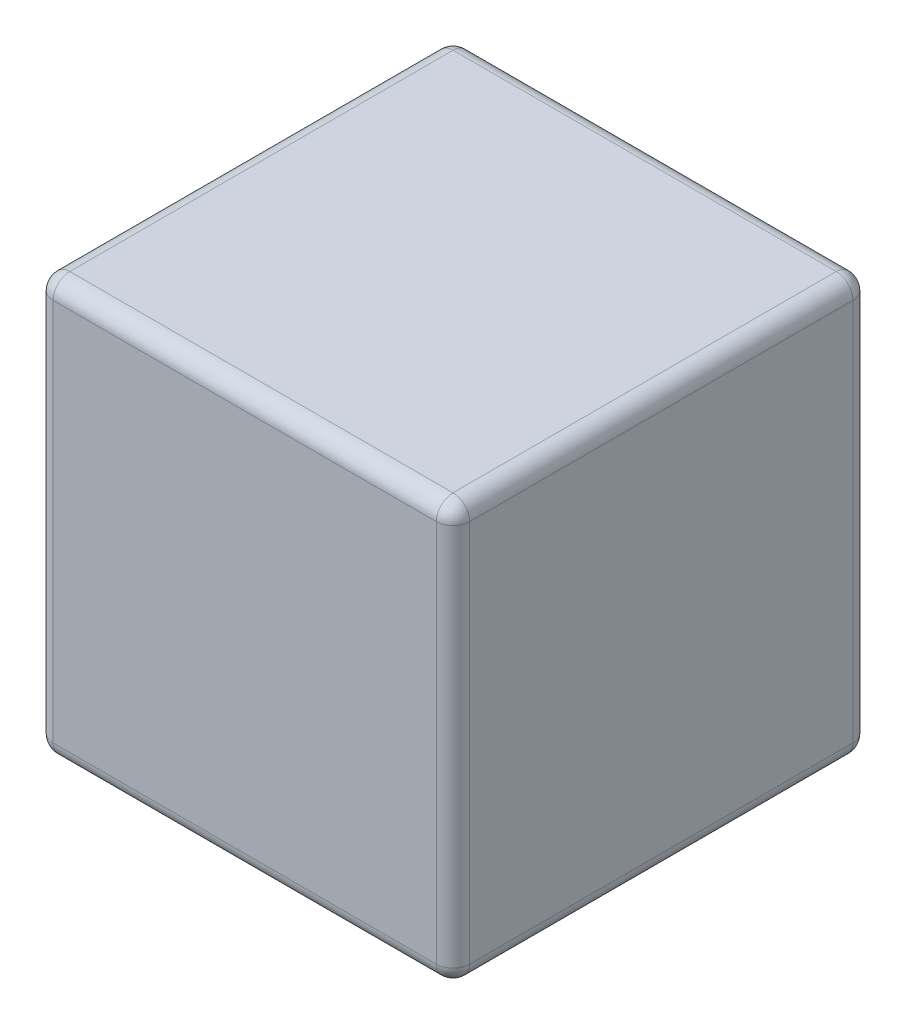
from build123d import *

# Parameters (mm, degrees)
SKETCH1_W           = 250
SKETCH1_H           = 250
BOSS_EXTRUDE1_DEPTH = 125
FILLET1_R           = 10
SKETCH2_W           = 2.243589744
SKETCH2_H           = 25
CUT_EXTRUDE1_DEPTH  = 5


with BuildPart() as part:
    # Sketch1 → Boss-Extrude1 (new, symmetric)
    with BuildSketch(Plane(origin=(0, 0, 0), x_dir=(1, 0, 0), z_dir=(0, 1, 0))):
        Rectangle(SKETCH1_W, SKETCH1_H)
    extrude(amount=BOSS_EXTRUDE1_DEPTH, both=True)

    # Fillet1
    fillet1_edges = [part.edges().sort_by_distance(p)[0] for p in [
        (-125, 125, 0),
        (0, 125, 125),
        (125, 125, 0),
        (0, -125, 125),
        (-125, -125, 0),
        (0, -125, -125),
        (125, -125, 0),
        (125, 0, 125),
        (-125, 0, 125),
        (-125, 0, -125),
        (125, 0, -125),
        (0, 125, -125),
    ]]
    fillet(fillet1_edges, radius=FILLET1_R)

    # Sketch2 → Cut-Extrude1 (cut)
    # profile 1 of 11: a face of its own
    with BuildSketch(Plane(origin=(0, 0, -125), x_dir=(-1, 0, 0), z_dir=(0, 0, -1))):
        Polygon((-103.958881832, 105.864219876), (-101.715292089, 105.864219876), (-101.715292089, 83.42832244), (-92.099907473, 83.42832244), (-92.099907473, 80.864219876), (-103.958881832, 80.864219876), align=None)
    # profile 2 of 11: a face of its own
    with BuildSketch(Plane(origin=(0, 0, -125), x_dir=(-1, 0, 0), z_dir=(0, 0, -1))):
        with Locations((-86.811445935, 93.364219876)):
            Rectangle(SKETCH2_W, SKETCH2_H)
    # profile 3 of 11: a face of its own
    with BuildSketch(Plane(origin=(0, 0, -125), x_dir=(-1, 0, 0), z_dir=(0, 0, -1))):
        Polygon((-79.279394653, 105.864219876), (-67.099907473, 105.864219876), (-67.099907473, 103.300117312), (-77.035804909, 103.300117312), (-77.035804909, 95.60780962), (-67.099907473, 95.60780962), (-67.099907473, 93.043707055), (-77.035804909, 93.043707055), (-77.035804909, 80.864219876), (-79.279394653, 80.864219876), align=None)
    # profile 4 of 11: a face of its own
    with BuildSketch(Plane(origin=(0, 0, -125), x_dir=(-1, 0, 0), z_dir=(0, 0, -1))):
        Polygon((-62.612727986, 105.864219876), (-48.510163884, 105.864219876), (-48.510163884, 103.300117312), (-60.369138243, 103.300117312), (-60.369138243, 95.60780962), (-48.510163884, 95.60780962), (-48.510163884, 93.043707055), (-60.369138243, 93.043707055), (-60.369138243, 83.42832244), (-48.510163884, 83.42832244), (-48.510163884, 80.864219876), (-62.612727986, 80.864219876), align=None)
    # profile 5 of 11: a face of its own
    with BuildSketch(Plane(origin=(0, 0, -125), x_dir=(-1, 0, 0), z_dir=(0, 0, -1))):
        with BuildLine():
            Line((-36.971702345, 85.686936222), (-34.858320935, 86.953963466))
            add(Edge.make_bspline(
                [(-34.858320935, 86.953963466), (-34.661762098, 86.624932145), (-34.28516295, 85.994520831), (-33.656938956, 85.142677685), (-33.005989591, 84.41866228), (-32.327494351, 83.826686512), (-31.625594722, 83.360623035), (-30.895708624, 83.030607094), (-30.14029569, 82.824778698), (-29.626196965, 82.79977808), (-29.369538884, 82.787296799)],
                knots=[0, 0, 0, 0, 1.272034388, 2.437168799, 3.508375237, 4.49857839, 5.41946034, 6.295179144, 7.148887113, 8, 8, 8, 8], degree=3))
            add(Edge.make_bspline(
                [(-29.369538884, 82.787296799), (-29.150347023, 82.793401603), (-28.715798644, 82.80550439), (-28.076068337, 82.921795833), (-27.45476975, 83.100453897), (-26.864708051, 83.356317694), (-26.314025091, 83.665878306), (-25.831120124, 84.039779574), (-25.413647887, 84.458395329), (-25.072154211, 84.925414291), (-24.810153959, 85.427679638), (-24.608782042, 85.943222147), (-24.497031516, 86.480140492), (-24.480197563, 86.841643798), (-24.471702345, 87.024075645)],
                knots=[0, 0, 0, 0, 1.095163259, 2.171163733, 3.241058638, 4.321873601, 5.38011039, 6.391990106, 7.366004449, 8.327778327, 9.272591725, 10.192022065, 11.087607919, 12, 12, 12, 12], degree=3))
            add(Edge.make_bspline(
                [(-24.471702345, 87.024075645), (-24.482233136, 87.232224572), (-24.503640695, 87.655360923), (-24.684579838, 88.279644158), (-24.969217315, 88.89744823), (-25.231807628, 89.279600127), (-25.36813664, 89.478001927)],
                knots=[0, 0, 0, 0, 0.938893495, 1.908633276, 2.914225137, 4, 4, 4, 4], degree=3))
            add(Edge.make_bspline(
                [(-25.36813664, 89.478001927), (-25.480069599, 89.621193524), (-25.715058844, 89.921806371), (-26.119041076, 90.369272339), (-26.59308475, 90.830832474), (-27.120967285, 91.324111453), (-27.72191792, 91.826167143), (-28.377114451, 92.360940557), (-29.103284872, 92.908094679), (-29.612566991, 93.275041576), (-29.875348179, 93.464380132)],
                knots=[0, 0, 0, 0, 0.722233717, 1.516239348, 2.393582979, 3.351407094, 4.387010283, 5.505090956, 6.712668013, 8, 8, 8, 8], degree=3))
            add(Edge.make_bspline(
                [(-29.875348179, 93.464380132), (-30.138376723, 93.651727187), (-30.64126727, 94.009920489), (-31.344542858, 94.541522517), (-31.973431879, 95.027550157), (-32.52513914, 95.472578815), (-32.999421975, 95.876668848), (-33.400017768, 96.235939842), (-33.716721747, 96.560108134), (-33.892833038, 96.770403432), (-33.971902666, 96.864820837)],
                knots=[0, 0, 0, 0, 1.452282411, 2.77665338, 3.964542531, 5.026858415, 5.96415736, 6.766646006, 7.446254459, 8, 8, 8, 8], degree=3))
            add(Edge.make_bspline(
                [(-33.971902666, 96.864820837), (-34.082420846, 97.011971101), (-34.29976968, 97.301361842), (-34.586669719, 97.753682255), (-34.830520882, 98.216705579), (-35.021680397, 98.69167604), (-35.182653389, 99.171925532), (-35.290924322, 99.663720144), (-35.358720014, 100.164853133), (-35.365662775, 100.502092423), (-35.369138243, 100.670910581)],
                knots=[0, 0, 0, 0, 1.068054152, 2.10047183, 3.106115577, 4.101338837, 5.06977816, 6.043150881, 7.020423561, 8, 8, 8, 8], degree=3))
            add(Edge.make_bspline(
                [(-35.369138243, 100.670910581), (-35.359815321, 100.935408971), (-35.341368749, 101.458752283), (-35.185365055, 102.223258215), (-34.9391301, 102.953161195), (-34.594166615, 103.641235007), (-34.149471237, 104.269563442), (-33.634857135, 104.845374064), (-33.021917947, 105.329435365), (-32.34939921, 105.752378639), (-31.613282266, 106.083420962), (-30.841918671, 106.333142249), (-30.034082442, 106.474636947), (-29.486917194, 106.494942411), (-29.209282473, 106.505245517)],
                knots=[0, 0, 0, 0, 1.005424448, 1.989358655, 2.955360095, 3.929531133, 4.905563448, 5.876582895, 6.856512386, 7.866279853, 8.892233794, 9.918561126, 10.94386622, 12, 12, 12, 12], degree=3))
            add(Edge.make_bspline(
                [(-29.209282473, 106.505245517), (-28.914681757, 106.495084434), (-28.328814959, 106.474877283), (-27.467034848, 106.299180631), (-26.637315445, 106.008461547), (-25.969863553, 105.678542561), (-25.447486686, 105.349032449), (-25.049110024, 105.048890847), (-24.645413947, 104.703354357), (-24.233142126, 104.311502599), (-23.819280273, 103.869740092), (-23.397684186, 103.381092314), (-22.96736798, 102.848545486), (-22.690540408, 102.468370481), (-22.548625422, 102.273474684)],
                knots=[0, 0, 0, 0, 1.286793592, 2.559021753, 3.825965368, 5.121522368, 5.803751409, 6.523245864, 7.299691795, 8.125521123, 9.008227632, 9.944561021, 10.946284179, 12, 12, 12, 12], degree=3))
            Line((-22.548625422, 102.273474684), (-24.576870614, 100.736014748))
            add(Edge.make_bspline(
                [(-24.576870614, 100.736014748), (-24.699341561, 100.893791108), (-24.935191968, 101.197631488), (-25.293259732, 101.623140885), (-25.630750074, 102.011830025), (-25.96325293, 102.349438082), (-26.27320744, 102.65445332), (-26.574043456, 102.91559444), (-26.861431679, 103.135420122), (-27.223695327, 103.370016979), (-27.678821886, 103.602563433), (-28.250140002, 103.799342562), (-28.847184824, 103.917593004), (-29.253825049, 103.933227915), (-29.459683114, 103.941142953)],
                knots=[0, 0, 0, 0, 1.181633172, 2.275549214, 3.290209073, 4.226197932, 5.078386478, 5.862611352, 6.581680152, 7.217281963, 8.414376989, 9.595101626, 10.782541182, 12, 12, 12, 12], degree=3))
            add(Edge.make_bspline(
                [(-29.459683114, 103.941142953), (-29.717943989, 103.932487953), (-30.215975756, 103.915797602), (-30.923048871, 103.733511992), (-31.55943405, 103.446498705), (-32.106238086, 103.044248861), (-32.561502208, 102.567670342), (-32.890826913, 102.019249948), (-33.089042375, 101.413661358), (-33.113230086, 100.991220956), (-33.125548499, 100.77607885)],
                knots=[0, 0, 0, 0, 1.14458467, 2.207223713, 3.21896685, 4.227309161, 5.202851033, 6.127160689, 7.046193047, 8, 8, 8, 8], degree=3))
            add(Edge.make_bspline(
                [(-33.125548499, 100.77607885), (-33.122740452, 100.642139718), (-33.117119765, 100.374042436), (-33.038728353, 99.977960851), (-32.938018861, 99.582879855), (-32.778428634, 99.190575692), (-32.558105037, 98.794187413), (-32.268782352, 98.386889287), (-31.904401551, 97.965091368), (-31.625280034, 97.690752984), (-31.477912281, 97.545910581)],
                knots=[0, 0, 0, 0, 0.858281714, 1.717966888, 2.583508476, 3.4729293, 4.427298488, 5.488583878, 6.674047936, 8, 8, 8, 8], degree=3))
            add(Edge.make_bspline(
                [(-31.477912281, 97.545910581), (-31.423188193, 97.497074682), (-31.293176284, 97.381051766), (-31.055491101, 97.191106904), (-30.74161397, 96.956801388), (-30.359741105, 96.666891984), (-29.902831378, 96.330595826), (-29.370834549, 95.952212882), (-28.769680743, 95.519459604), (-28.343095629, 95.216905742), (-28.117535679, 95.056928209)],
                knots=[0, 0, 0, 0, 0.420754252, 0.999615792, 1.744751191, 2.668019286, 3.750313428, 4.999500688, 6.413464383, 8, 8, 8, 8], degree=3))
            add(Edge.make_bspline(
                [(-28.117535679, 95.056928209), (-27.846207726, 94.859489927), (-27.320818752, 94.477178057), (-26.57326461, 93.902780343), (-25.895451695, 93.341010567), (-25.285000241, 92.795456231), (-24.735879466, 92.270255566), (-24.254181462, 91.759089993), (-23.834998031, 91.265621616), (-23.383717899, 90.632960361), (-22.922590616, 89.855952617), (-22.526579849, 88.903965198), (-22.276877367, 87.948277195), (-22.244223686, 87.305942649), (-22.228112602, 86.989019555)],
                knots=[0, 0, 0, 0, 1.163667725, 2.253281268, 3.268753668, 4.215851969, 5.092017293, 5.902905408, 6.650798638, 7.335211899, 8.59617414, 9.77448103, 10.901945474, 12, 12, 12, 12], degree=3))
            add(Edge.make_bspline(
                [(-22.228112602, 86.989019555), (-22.232806445, 86.764888376), (-22.242102982, 86.320978494), (-22.348966651, 85.669156516), (-22.505535688, 85.036078875), (-22.741515931, 84.429570929), (-23.02953849, 83.83853691), (-23.395011689, 83.278480479), (-23.818638008, 82.737006203), (-24.304593472, 82.228552693), (-24.836349917, 81.761794151), (-25.398376308, 81.346586569), (-25.991592543, 81.000384259), (-26.612780519, 80.717878244), (-27.262082924, 80.496924547), (-27.93928138, 80.336832625), (-28.645492175, 80.238577547), (-29.125495614, 80.228379251), (-29.369538884, 80.223194235)],
                knots=[0, 0, 0, 0, 0.983748083, 1.948392443, 2.894712957, 3.844097841, 4.80183111, 5.778335162, 6.776009319, 7.81870978, 8.863265674, 9.881300176, 10.883814829, 11.87499822, 12.874611388, 13.892143829, 14.928324115, 16, 16, 16, 16], degree=3))
            add(Edge.make_bspline(
                [(-29.369538884, 80.223194235), (-29.558362762, 80.226845532), (-29.933632477, 80.234102142), (-30.488700205, 80.298254145), (-31.032554413, 80.389019171), (-31.558370713, 80.53311967), (-32.072923654, 80.707955221), (-32.573975329, 80.923229025), (-33.061768571, 81.181209035), (-33.53903702, 81.476173497), (-34.004566838, 81.819443101), (-34.453991609, 82.21925379), (-34.90205722, 82.664578826), (-35.335538622, 83.167511421), (-35.763203939, 83.719926299), (-36.17662115, 84.326991894), (-36.584347704, 84.985401564), (-36.840172475, 85.448723605), (-36.971702345, 85.686936222)],
                knots=[0, 0, 0, 0, 0.915332311, 1.819136955, 2.706846663, 3.586547465, 4.459518054, 5.340707479, 6.227863349, 7.133153174, 8.059268498, 9.028702269, 10.047606654, 11.120612155, 12.245963614, 13.433783089, 14.680604001, 16, 16, 16, 16], degree=3))
        make_face()
    # profile 6 of 11: a face of its own
    with BuildSketch(Plane(origin=(0, 0, -125), x_dir=(-1, 0, 0), z_dir=(0, 0, -1))):
        with BuildLine():
            Line((-17.099907473, 105.864219876), (-14.85631773, 105.864219876))
            Line((-14.85631773, 105.864219876), (-14.85631773, 90.88525353))
            add(Edge.make_bspline(
                [(-14.85631773, 90.88525353), (-14.856651615, 90.673248274), (-14.857285221, 90.270931768), (-14.853052979, 89.69830105), (-14.841200347, 89.189212056), (-14.833727779, 88.741702431), (-14.817103968, 88.357825663), (-14.80354649, 88.035502016), (-14.786113942, 87.776257712), (-14.765163103, 87.624965383), (-14.756157473, 87.559933017)],
                knots=[0, 0, 0, 0, 1.528628734, 2.90083645, 4.128790002, 5.200304208, 6.127813768, 6.898992206, 7.526736466, 8, 8, 8, 8], degree=3))
            add(Edge.make_bspline(
                [(-14.756157473, 87.559933017), (-14.719175625, 87.325313279), (-14.647295722, 86.869293785), (-14.46410731, 86.219948915), (-14.208268017, 85.634724213), (-13.905103426, 85.095357848), (-13.505584774, 84.616862419), (-13.026988093, 84.176064899), (-12.447146889, 83.790552008), (-11.802428277, 83.43804621), (-11.107533724, 83.154724193), (-10.39745325, 82.940485876), (-9.682860541, 82.809922306), (-9.204459362, 82.794804171), (-8.966894653, 82.787296799)],
                knots=[0, 0, 0, 0, 1.035780045, 2.013197591, 2.933192213, 3.817615948, 4.702609284, 5.640816605, 6.646850145, 7.73207398, 8.84249596, 9.914020372, 10.964143139, 12, 12, 12, 12], degree=3))
            add(Edge.make_bspline(
                [(-8.966894653, 82.787296799), (-8.762939364, 82.794967158), (-8.356206779, 82.810263575), (-7.751875132, 82.904988082), (-7.163302927, 83.075706408), (-6.587583785, 83.295990397), (-6.047933896, 83.587044619), (-5.544052167, 83.923264901), (-5.09430978, 84.317628301), (-4.68389551, 84.754059333), (-4.326503111, 85.246486476), (-4.016709242, 85.784187462), (-3.762952602, 86.375254226), (-3.63764171, 86.790642956), (-3.573264845, 87.004043594)],
                knots=[0, 0, 0, 0, 0.994687771, 1.983630487, 2.973142513, 3.978332533, 4.983357753, 5.956394766, 6.925816176, 7.893390482, 8.871859704, 9.88551698, 10.913711441, 12, 12, 12, 12], degree=3))
            add(Edge.make_bspline(
                [(-3.573264845, 87.004043594), (-3.551835379, 87.092247696), (-3.504081892, 87.288801983), (-3.459460142, 87.621096915), (-3.41298496, 88.013163801), (-3.380738032, 88.467819606), (-3.349300743, 88.983540839), (-3.33049308, 89.563014107), (-3.321799988, 90.204135256), (-3.319209414, 90.651543554), (-3.317856191, 90.88525353)],
                knots=[0, 0, 0, 0, 0.558680831, 1.244966039, 2.062412453, 2.990489873, 4.051219941, 5.244515665, 6.560634259, 8, 8, 8, 8], degree=3))
            Line((-3.317856191, 90.88525353), (-3.317856191, 105.864219876))
            Line((-3.317856191, 105.864219876), (-1.074266448, 105.864219876))
            Line((-1.074266448, 105.864219876), (-1.074266448, 90.765061222))
            add(Edge.make_bspline(
                [(-1.074266448, 90.765061222), (-1.076081593, 90.492929944), (-1.07962396, 89.961849209), (-1.110342364, 89.183625216), (-1.159320934, 88.445389635), (-1.228521563, 87.747043231), (-1.320214443, 87.091084951), (-1.422180303, 86.471765178), (-1.552034111, 85.893529517), (-1.703701262, 85.351869391), (-1.877083748, 84.83625858), (-2.101663379, 84.346911333), (-2.354695522, 83.868951335), (-2.654800185, 83.409607701), (-2.992024347, 82.966846607), (-3.373822067, 82.543353214), (-3.787566073, 82.132360026), (-4.240134356, 81.744409554), (-4.724066679, 81.38863329), (-5.237923519, 81.075792068), (-5.777757589, 80.811337658), (-6.342165633, 80.593652483), (-6.931388511, 80.429976775), (-7.54544108, 80.308011376), (-8.185721032, 80.238709251), (-8.621182862, 80.228409751), (-8.841694332, 80.223194235)],
                knots=[0, 0, 0, 0, 1.316592851, 2.569410997, 3.76748051, 4.895814652, 5.963796859, 6.97159953, 7.931736103, 8.829262218, 9.692595152, 10.560224239, 11.431080259, 12.30701507, 13.211635791, 14.121146779, 15.063487852, 16.031507147, 17.00238618, 17.966455255, 18.938106653, 19.907068911, 20.888905087, 21.893141452, 22.933117798, 24, 24, 24, 24], degree=3))
            add(Edge.make_bspline(
                [(-8.841694332, 80.223194235), (-9.082187923, 80.228799701), (-9.554035486, 80.239797606), (-10.249307395, 80.302817249), (-10.915837369, 80.421520066), (-11.560665062, 80.572662521), (-12.17501147, 80.781117787), (-12.767107501, 81.024675822), (-13.326812366, 81.32379911), (-13.863206142, 81.65660906), (-14.3619544, 82.031070761), (-14.819792994, 82.439214861), (-15.237477784, 82.874503271), (-15.607968472, 83.341648741), (-15.937403362, 83.837018076), (-16.221190601, 84.362012646), (-16.46485663, 84.91642919), (-16.590617823, 85.301809193), (-16.654194332, 85.496631735)],
                knots=[0, 0, 0, 0, 1.13879206, 2.234305948, 3.301075583, 4.341971843, 5.366689343, 6.369221514, 7.369726634, 8.367512178, 9.355451585, 10.318319045, 11.268648973, 12.207971039, 13.137398894, 14.081662264, 15.030215811, 16, 16, 16, 16], degree=3))
            add(Edge.make_bspline(
                [(-16.654194332, 85.496631735), (-16.691174034, 85.629721552), (-16.771383829, 85.918396331), (-16.857278812, 86.396156963), (-16.929486538, 86.946263518), (-16.997383383, 87.568753649), (-17.037447368, 88.264109839), (-17.07257193, 89.032030667), (-17.100154922, 89.873444679), (-17.099992262, 90.459548362), (-17.099907473, 90.765061222)],
                knots=[0, 0, 0, 0, 0.625038921, 1.35572334, 2.194682327, 3.136881307, 4.189498639, 5.346923369, 6.617055217, 8, 8, 8, 8], degree=3))
            Line((-17.099907473, 90.765061222), (-17.099907473, 105.864219876))
        make_face()
    # profile 7 of 11: a face of its own
    with BuildSketch(Plane(origin=(0, 0, -125), x_dir=(-1, 0, 0), z_dir=(0, 0, -1))):
        with BuildLine():
            Line((5.335989962, 105.864219876), (10.238834514, 105.864219876))
            add(Edge.make_bspline(
                [(10.238834514, 105.864219876), (10.576055272, 105.863849189), (11.222185221, 105.863138935), (12.148721333, 105.841605036), (12.990219416, 105.81284295), (13.744864994, 105.772972284), (14.41497998, 105.725853782), (14.99753212, 105.659767787), (15.497100379, 105.590765676), (15.796432161, 105.520612772), (15.932945091, 105.488618914)],
                knots=[0, 0, 0, 0, 1.415646017, 2.712440637, 3.8905458, 4.950247383, 5.884950622, 6.709939814, 7.411656543, 8, 8, 8, 8], degree=3))
            add(Edge.make_bspline(
                [(15.932945091, 105.488618914), (16.105756046, 105.441319273), (16.447305883, 105.347834546), (16.939456191, 105.160593664), (17.407697945, 104.938578199), (17.853637648, 104.685550057), (18.271795384, 104.39065317), (18.668409962, 104.065841615), (19.03998125, 103.703616125), (19.384419764, 103.308039412), (19.700739747, 102.885752198), (19.973094623, 102.430450556), (20.201146245, 101.949798389), (20.396741041, 101.444130023), (20.537515716, 100.909199141), (20.643565, 100.348722624), (20.710876625, 99.762760551), (20.717323495, 99.362332926), (20.720605347, 99.158490709)],
                knots=[0, 0, 0, 0, 0.999701418, 1.975846123, 2.934577507, 3.890451536, 4.834027766, 5.787354733, 6.749476667, 7.726910423, 8.712836071, 9.690891519, 10.682875813, 11.679750201, 12.712814741, 13.765529915, 14.8625177, 16, 16, 16, 16], degree=3))
            add(Edge.make_bspline(
                [(20.720605347, 99.158490709), (20.71759517, 98.952935161), (20.711705557, 98.550751847), (20.641017804, 97.962374788), (20.54580215, 97.400100573), (20.399394633, 96.865175927), (20.207639825, 96.360777566), (19.982696591, 95.879197338), (19.711385659, 95.428628253), (19.399636876, 95.007434556), (19.052839773, 94.615220897), (18.672461643, 94.254829507), (18.260038126, 93.928369947), (17.816879925, 93.63511035), (17.338666719, 93.38185121), (16.832651336, 93.155013318), (16.294435505, 92.964505742), (15.921988976, 92.864291017), (15.732624578, 92.813338466)],
                knots=[0, 0, 0, 0, 1.121902311, 2.195077645, 3.232258892, 4.234102512, 5.217864754, 6.176164875, 7.132989551, 8.084763148, 9.034132444, 9.988522005, 10.94243251, 11.903244335, 12.886203696, 13.894208494, 14.929344452, 16, 16, 16, 16], degree=3))
            add(Edge.make_bspline(
                [(15.732624578, 92.813338466), (15.576000764, 92.780031458), (15.232750568, 92.707037214), (14.66744541, 92.625548237), (14.009264082, 92.555993946), (13.259104939, 92.503842963), (12.417641333, 92.459197474), (11.484418066, 92.423711089), (10.457603229, 92.404212133), (9.741380057, 92.40320647), (9.367440283, 92.402681414)],
                knots=[0, 0, 0, 0, 0.601384939, 1.31797006, 2.144135048, 3.087295005, 4.142315834, 5.309527816, 6.595305764, 8, 8, 8, 8], degree=3))
            Line((9.367440283, 92.402681414), (7.579579706, 92.402681414))
            Line((7.579579706, 92.402681414), (7.579579706, 80.864219876))
            Line((7.579579706, 80.864219876), (5.335989962, 80.864219876))
            Line((5.335989962, 80.864219876), (5.335989962, 105.864219876))
        make_face()
        with BuildLine():
            Line((7.579579706, 103.300117312), (7.579579706, 94.966783979))
            Line((7.579579706, 94.966783979), (11.956582911, 94.911695837))
            add(Edge.make_bspline(
                [(11.956582911, 94.911695837), (12.170296667, 94.911585383), (12.582866666, 94.911372154), (13.17883969, 94.939838036), (13.73176317, 94.972698983), (14.239938709, 95.020812722), (14.703595384, 95.088821704), (15.123506304, 95.157476975), (15.496415468, 95.256800994), (15.932838337, 95.390537202), (16.419147962, 95.618627314), (16.94820188, 95.949697957), (17.396563211, 96.371703016), (17.784551045, 96.846187525), (18.092450173, 97.374038449), (18.317850119, 97.938816569), (18.450286957, 98.53472978), (18.468045483, 98.9425022), (18.477015603, 99.148474684)],
                knots=[0, 0, 0, 0, 1.160613943, 2.240541288, 3.23993089, 4.169200891, 5.011653406, 5.7853311, 6.478053781, 7.106038997, 8.262395093, 9.384106736, 10.481365981, 11.59014053, 12.70357646, 13.786202915, 14.881775077, 16, 16, 16, 16], degree=3))
            add(Edge.make_bspline(
                [(18.477015603, 99.148474684), (18.4679967, 99.349464065), (18.450068236, 99.749006081), (18.31681207, 100.334568657), (18.0928884, 100.893395117), (17.782484153, 101.41463144), (17.405761797, 101.887408612), (16.967909346, 102.298102376), (16.469957479, 102.628257396), (16.006755829, 102.841352265), (15.595318786, 102.971461375), (15.237947644, 103.06249595), (14.834442826, 103.135178851), (14.384672972, 103.194032443), (13.892124159, 103.244414309), (13.352564767, 103.27859986), (12.768038744, 103.298610262), (12.362248952, 103.2996028), (12.151895411, 103.300117312)],
                knots=[0, 0, 0, 0, 1.120700087, 2.227813068, 3.331159281, 4.466773991, 5.599788987, 6.693661531, 7.80175334, 8.91857717, 9.525282508, 10.207424825, 10.974604443, 11.810962634, 12.737642355, 13.736264703, 14.826523623, 16, 16, 16, 16], degree=3))
            Line((12.151895411, 103.300117312), (7.579579706, 103.300117312))
        make_face(mode=Mode.SUBTRACT)
    # profile 8 of 11: a face of its own
    with BuildSketch(Plane(origin=(0, 0, -125), x_dir=(-1, 0, 0), z_dir=(0, 0, -1))):
        with BuildLine():
            Line((25.848810475, 105.864219876), (30.751655027, 105.864219876))
            add(Edge.make_bspline(
                [(30.751655027, 105.864219876), (31.088875785, 105.863849189), (31.735005733, 105.863138935), (32.661541846, 105.841605036), (33.503039929, 105.81284295), (34.257685507, 105.772972284), (34.927800493, 105.725853782), (35.510352633, 105.659767787), (36.009920892, 105.590765676), (36.309252674, 105.520612772), (36.445765603, 105.488618914)],
                knots=[0, 0, 0, 0, 1.415646017, 2.712440637, 3.8905458, 4.950247383, 5.884950622, 6.709939814, 7.411656543, 8, 8, 8, 8], degree=3))
            add(Edge.make_bspline(
                [(36.445765603, 105.488618914), (36.618576559, 105.441319273), (36.960126396, 105.347834546), (37.452276704, 105.160593664), (37.920518458, 104.938578199), (38.366458161, 104.685550057), (38.784615897, 104.39065317), (39.181230475, 104.065841615), (39.552801763, 103.703616125), (39.897240277, 103.308039412), (40.213560259, 102.885752198), (40.485915136, 102.430450556), (40.713966758, 101.949798389), (40.909561554, 101.444130023), (41.050336229, 100.909199141), (41.156385512, 100.348722624), (41.223697138, 99.762760551), (41.230144008, 99.362332926), (41.23342586, 99.158490709)],
                knots=[0, 0, 0, 0, 0.999701418, 1.975846123, 2.934577507, 3.890451536, 4.834027766, 5.787354733, 6.749476667, 7.726910423, 8.712836071, 9.690891519, 10.682875813, 11.679750201, 12.712814741, 13.765529915, 14.8625177, 16, 16, 16, 16], degree=3))
            add(Edge.make_bspline(
                [(41.23342586, 99.158490709), (41.230415683, 98.952935161), (41.224526069, 98.550751847), (41.153838317, 97.962374788), (41.058622663, 97.400100573), (40.912215146, 96.865175927), (40.720460338, 96.360777566), (40.495517103, 95.879197338), (40.224206172, 95.428628253), (39.912457389, 95.007434556), (39.565660286, 94.615220897), (39.185282156, 94.254829507), (38.772858638, 93.928369947), (38.329700438, 93.63511035), (37.851487232, 93.38185121), (37.345471849, 93.155013318), (36.807256018, 92.964505742), (36.434809489, 92.864291017), (36.245445091, 92.813338466)],
                knots=[0, 0, 0, 0, 1.121902311, 2.195077645, 3.232258892, 4.234102512, 5.217864754, 6.176164875, 7.132989551, 8.084763148, 9.034132444, 9.988522005, 10.94243251, 11.903244335, 12.886203696, 13.894208494, 14.929344452, 16, 16, 16, 16], degree=3))
            add(Edge.make_bspline(
                [(36.245445091, 92.813338466), (36.088821276, 92.780031458), (35.745571081, 92.707037214), (35.180265923, 92.625548237), (34.522084594, 92.555993946), (33.771925452, 92.503842963), (32.930461846, 92.459197474), (31.997238579, 92.423711089), (30.970423742, 92.404212133), (30.25420057, 92.40320647), (29.880260796, 92.402681414)],
                knots=[0, 0, 0, 0, 0.601384939, 1.31797006, 2.144135048, 3.087295005, 4.142315834, 5.309527816, 6.595305764, 8, 8, 8, 8], degree=3))
            Line((29.880260796, 92.402681414), (28.092400219, 92.402681414))
            Line((28.092400219, 92.402681414), (28.092400219, 80.864219876))
            Line((28.092400219, 80.864219876), (25.848810475, 80.864219876))
            Line((25.848810475, 80.864219876), (25.848810475, 105.864219876))
        make_face()
        with BuildLine():
            Line((28.092400219, 103.300117312), (28.092400219, 94.966783979))
            Line((28.092400219, 94.966783979), (32.469403424, 94.911695837))
            add(Edge.make_bspline(
                [(32.469403424, 94.911695837), (32.68311718, 94.911585383), (33.095687179, 94.911372154), (33.691660202, 94.939838036), (34.244583683, 94.972698983), (34.752759222, 95.020812722), (35.216415896, 95.088821704), (35.636326817, 95.157476975), (36.00923598, 95.256800994), (36.44565885, 95.390537202), (36.931968475, 95.618627314), (37.461022393, 95.949697957), (37.909383724, 96.371703016), (38.297371558, 96.846187525), (38.605270686, 97.374038449), (38.830670631, 97.938816569), (38.96310747, 98.53472978), (38.980865996, 98.9425022), (38.989836116, 99.148474684)],
                knots=[0, 0, 0, 0, 1.160613943, 2.240541288, 3.23993089, 4.169200891, 5.011653406, 5.7853311, 6.478053781, 7.106038997, 8.262395093, 9.384106736, 10.481365981, 11.59014053, 12.70357646, 13.786202915, 14.881775077, 16, 16, 16, 16], degree=3))
            add(Edge.make_bspline(
                [(38.989836116, 99.148474684), (38.980817213, 99.349464065), (38.962888749, 99.749006081), (38.829632583, 100.334568657), (38.605708913, 100.893395117), (38.295304666, 101.41463144), (37.918582309, 101.887408612), (37.480729859, 102.298102376), (36.982777992, 102.628257396), (36.519576342, 102.841352265), (36.108139299, 102.971461375), (35.750768157, 103.06249595), (35.347263339, 103.135178851), (34.897493485, 103.194032443), (34.404944672, 103.244414309), (33.86538528, 103.27859986), (33.280859256, 103.298610262), (32.875069465, 103.2996028), (32.664715924, 103.300117312)],
                knots=[0, 0, 0, 0, 1.120700087, 2.227813068, 3.331159281, 4.466773991, 5.599788987, 6.693661531, 7.80175334, 8.91857717, 9.525282508, 10.207424825, 10.974604443, 11.810962634, 12.737642355, 13.736264703, 14.826523623, 16, 16, 16, 16], degree=3))
            Line((32.664715924, 103.300117312), (28.092400219, 103.300117312))
        make_face(mode=Mode.SUBTRACT)
    # profile 9 of 11: a face of its own
    with BuildSketch(Plane(origin=(0, 0, -125), x_dir=(-1, 0, 0), z_dir=(0, 0, -1))):
        with BuildLine():
            add(Edge.make_bspline(
                [(58.060348937, 106.505245517), (58.523263979, 106.493520664), (59.432467314, 106.470492086), (60.768716584, 106.294212775), (62.044395836, 105.989245704), (63.269896827, 105.583081543), (64.430560946, 105.041264505), (65.535124463, 104.386370588), (66.580959276, 103.61153874), (67.553969145, 102.722758548), (68.444375932, 101.755733878), (69.228846549, 100.723748806), (69.886291504, 99.633043075), (70.426189983, 98.486894285), (70.849751481, 97.287894513), (71.142030365, 96.029651637), (71.328731437, 94.720318136), (71.350558419, 93.827269102), (71.361630988, 93.374235902)],
                knots=[0, 0, 0, 0, 1.065120563, 2.091984664, 3.0946048, 4.079830382, 5.057816894, 6.036188127, 7.030412546, 8.04752943, 9.064399622, 10.05169764, 11.02544977, 11.989514704, 12.962713494, 13.945757189, 14.957906945, 16, 16, 16, 16], degree=3))
            add(Edge.make_bspline(
                [(71.361630988, 93.374235902), (71.350560041, 92.924539856), (71.328737923, 92.038136853), (71.141818084, 90.737112252), (70.848668084, 89.48646442), (70.430123325, 88.288281186), (69.892798479, 87.141298587), (69.230975828, 86.048534631), (68.451395752, 85.009631071), (67.564203958, 84.035969177), (66.597053658, 83.1431301), (65.55969461, 82.365138131), (64.47545661, 81.695680098), (63.330387266, 81.161510999), (62.139672717, 80.73456871), (60.892656124, 80.443478495), (59.595180738, 80.255713901), (58.710387854, 80.234153072), (58.26066945, 80.223194235)],
                knots=[0, 0, 0, 0, 1.043624062, 2.057103931, 3.04512605, 4.022047818, 4.998200453, 5.980619268, 6.982898556, 8.009068085, 9.034988726, 10.034168286, 11.015286542, 11.987931943, 12.962482838, 13.94673481, 14.956375938, 16, 16, 16, 16], degree=3))
            add(Edge.make_bspline(
                [(58.26066945, 80.223194235), (57.8076386, 80.234261284), (56.9145942, 80.256077383), (55.603615376, 80.443087418), (54.344488634, 80.735525302), (53.140814697, 81.153449846), (51.991922343, 81.693572923), (50.895564609, 82.352175631), (49.856142129, 83.13365521), (48.882272511, 84.020559315), (47.99120681, 84.9860704), (47.214354126, 86.020600794), (46.555603317, 87.103854056), (46.017293799, 88.238836371), (45.59111909, 89.420060961), (45.300370389, 90.655407229), (45.112256445, 91.937832271), (45.09057897, 92.81099583), (45.079579706, 93.254043594)],
                knots=[0, 0, 0, 0, 1.053102029, 2.075944431, 3.073151272, 4.055350789, 5.033113405, 6.020478099, 7.024410459, 8.052272461, 9.079885166, 10.07527673, 11.055994387, 12.023226415, 12.992069828, 13.970394897, 14.97016774, 16, 16, 16, 16], degree=3))
            add(Edge.make_bspline(
                [(45.079579706, 93.254043594), (45.083398531, 93.551419802), (45.090988005, 94.142420684), (45.182357237, 95.020039257), (45.314940817, 95.883543955), (45.504954478, 96.730479298), (45.753466385, 97.558772046), (46.046695152, 98.374134637), (46.404836905, 99.168304093), (46.809698676, 99.945042605), (47.261568734, 100.692241932), (47.76068123, 101.398524669), (48.28950529, 102.069817503), (48.869243816, 102.688724673), (49.480789853, 103.27325079), (50.134063983, 103.814413055), (50.825080014, 104.317091276), (51.556811298, 104.770093712), (52.311227547, 105.179801817), (53.088918817, 105.531386467), (53.879322899, 105.833144049), (54.686141813, 106.077721372), (55.507233042, 106.270807343), (56.344388646, 106.402288441), (57.196941691, 106.493890712), (57.771308255, 106.501444297), (58.060348937, 106.505245517)],
                knots=[0, 0, 0, 0, 1.037015668, 2.060948919, 3.074880161, 4.083647147, 5.086022904, 6.090072063, 7.104153813, 8.122640571, 9.144368836, 10.147691507, 11.138137339, 12.123020368, 13.103399296, 14.087645067, 15.080126199, 16.082011238, 17.087798457, 18.072939717, 19.057185487, 20.037253025, 21.01195951, 21.997135196, 22.992090687, 24, 24, 24, 24], degree=3))
        make_face()
        with BuildLine():
            add(Edge.make_bspline(
                [(58.170525219, 103.941142953), (57.933277836, 103.93825088), (57.461051173, 103.932494382), (56.759018771, 103.856667842), (56.066219243, 103.748597206), (55.382509514, 103.594443487), (54.710750304, 103.384414538), (54.04468001, 103.142693765), (53.390372482, 102.848257404), (52.749987783, 102.51559523), (52.129165818, 102.147388653), (51.543360807, 101.74044746), (50.991056208, 101.304314929), (50.473604303, 100.837973234), (49.992524502, 100.339047507), (49.538348063, 99.815101534), (49.129279622, 99.251159455), (48.754382645, 98.662513692), (48.418898072, 98.049930969), (48.120574109, 97.419860524), (47.876545475, 96.767162762), (47.677528502, 96.098918779), (47.512529853, 95.416186924), (47.408001823, 94.713788004), (47.331342113, 93.99525149), (47.325914646, 93.509666818), (47.32316945, 93.26405962)],
                knots=[0, 0, 0, 0, 1.008559885, 2.007477868, 2.99961109, 3.989939068, 4.984837346, 5.991145699, 7.001802488, 8.033829008, 9.059044045, 10.069351652, 11.065060232, 12.050310815, 13.029377138, 14.011219647, 14.996725999, 15.989392538, 16.977580475, 17.965360261, 18.951710183, 19.937753436, 20.929683414, 21.935841486, 22.955955122, 24, 24, 24, 24], degree=3))
            add(Edge.make_bspline(
                [(47.32316945, 93.26405962), (47.332275606, 92.9029009), (47.350190234, 92.192389969), (47.507030021, 91.151188941), (47.748615552, 90.150558325), (48.104739598, 89.195973258), (48.550101132, 88.279228381), (49.100293205, 87.408456205), (49.752143816, 86.583421388), (50.492597578, 85.809883752), (51.302045482, 85.103842293), (52.161564981, 84.48410366), (53.061947892, 83.959744733), (54.005542197, 83.532565644), (54.987310333, 83.194067517), (56.013578555, 82.962077295), (57.077510409, 82.809395471), (57.802729374, 82.794732929), (58.170525219, 82.787296799)],
                knots=[0, 0, 0, 0, 1.032063989, 2.030389145, 3.003944642, 3.970395727, 4.937377036, 5.913328081, 6.909231446, 7.93887556, 8.970685674, 9.976071282, 10.964166581, 11.944589148, 12.933237628, 13.927779006, 14.949070134, 16, 16, 16, 16], degree=3))
            add(Edge.make_bspline(
                [(58.170525219, 82.787296799), (58.417735945, 82.790693259), (58.908029062, 82.797429459), (59.637282793, 82.86527715), (60.353398591, 82.974076218), (61.055372018, 83.130723758), (61.742406386, 83.326775232), (62.417369265, 83.559687575), (63.073071339, 83.850267601), (63.717784466, 84.171324398), (64.334900478, 84.537325523), (64.924011423, 84.930455164), (65.470268422, 85.365945312), (65.987333218, 85.825358258), (66.470388139, 86.317957172), (66.916166598, 86.843101613), (67.323167542, 87.404106308), (67.69792216, 87.991859206), (68.03223118, 88.606118154), (68.323510459, 89.238472996), (68.570625572, 89.887366635), (68.770114892, 90.553735002), (68.926439619, 91.236312494), (69.034153332, 91.936013052), (69.109499322, 92.651436927), (69.115178445, 93.135321612), (69.118041244, 93.379243914)],
                knots=[0, 0, 0, 0, 1.047197238, 2.076906641, 3.100256066, 4.114471768, 5.12198147, 6.126382909, 7.136867548, 8.15857795, 9.17633901, 10.174870724, 11.156907918, 12.133735059, 13.104061851, 14.077631395, 15.04955518, 16.038496417, 17.029181396, 18.010275684, 18.986308667, 19.968651475, 20.955262928, 21.950658345, 22.966943676, 24, 24, 24, 24], degree=3))
            add(Edge.make_bspline(
                [(69.118041244, 93.379243914), (69.115176152, 93.621497516), (69.109492713, 94.10205216), (69.034189322, 94.812486577), (68.92632582, 95.507152374), (68.770877905, 96.183322395), (68.570519664, 96.841169003), (68.323467304, 97.480074343), (68.032143737, 98.102418594), (67.697799277, 98.706663572), (67.321971966, 99.286483129), (66.9112988, 99.840786076), (66.45868917, 100.3591628), (65.977074707, 100.854410614), (65.454425526, 101.315966969), (64.89310914, 101.743984973), (64.299940013, 102.148794075), (63.671888331, 102.51397666), (63.023717233, 102.851221179), (62.358617533, 103.140156916), (61.684123964, 103.385672055), (61.001951734, 103.595078948), (60.306359031, 103.747993449), (59.602045968, 103.856765234), (58.889986978, 103.93246799), (58.411106837, 103.938242122), (58.170525219, 103.941142953)],
                knots=[0, 0, 0, 0, 1.02996197, 2.043119294, 3.035359645, 4.018872909, 4.991431989, 5.957985074, 6.929999688, 7.912076566, 8.892894881, 9.867085534, 10.843653904, 11.817741046, 12.803660682, 13.806313499, 14.818574707, 15.856120519, 16.894564902, 17.924820532, 18.937903209, 19.946497019, 20.957711757, 21.963978472, 22.977135795, 24, 24, 24, 24], degree=3))
        make_face(mode=Mode.SUBTRACT)
    # profile 10 of 11: a face of its own
    with BuildSketch(Plane(origin=(0, 0, -125), x_dir=(-1, 0, 0), z_dir=(0, 0, -1))):
        with BuildLine():
            Line((76.489836116, 105.864219876), (81.492840924, 105.864219876))
            add(Edge.make_bspline(
                [(81.492840924, 105.864219876), (81.826706128, 105.863108547), (82.467764302, 105.860974674), (83.386144805, 105.849076367), (84.220624069, 105.814973826), (84.970765778, 105.785626802), (85.636556171, 105.732112935), (86.220036819, 105.680965456), (86.718520373, 105.614010736), (87.020276453, 105.551829143), (87.156903424, 105.523675004)],
                knots=[0, 0, 0, 0, 1.410062039, 2.707475311, 3.878576406, 4.937260626, 5.877586885, 6.699081471, 7.410979367, 8, 8, 8, 8], degree=3))
            add(Edge.make_bspline(
                [(87.156903424, 105.523675004), (87.339807882, 105.478483823), (87.70171495, 105.389065511), (88.22278685, 105.200068362), (88.719317735, 104.981356758), (89.189245052, 104.724473041), (89.630214989, 104.427510329), (90.046774352, 104.095595169), (90.440813376, 103.730543699), (90.796396449, 103.323151974), (91.131675389, 102.895748334), (91.414451293, 102.433578642), (91.658211862, 101.950282017), (91.852286984, 101.440943319), (92.008558223, 100.910502091), (92.118745647, 100.354153543), (92.184825559, 99.774432292), (92.191553098, 99.379018658), (92.194964321, 99.178522761)],
                knots=[0, 0, 0, 0, 1.027469482, 2.033020251, 3.019912614, 3.986113645, 4.951240523, 5.91722682, 6.890402269, 7.87763091, 8.8651537, 9.85103654, 10.82876324, 11.815024772, 12.821070561, 13.842952187, 14.906261191, 16, 16, 16, 16], degree=3))
            add(Edge.make_bspline(
                [(92.194964321, 99.178522761), (92.184471478, 98.84541487), (92.163997222, 98.1954351), (91.973103624, 97.25214309), (91.660414198, 96.372219414), (91.229533562, 95.556772), (90.680823021, 94.821695962), (90.021360228, 94.176049853), (89.250777288, 93.635764763), (88.533425032, 93.261101872), (87.899752177, 93.021152525), (87.378085657, 92.85232139), (86.809035818, 92.721878781), (86.198054856, 92.605020697), (85.542600174, 92.516794308), (84.84424275, 92.452175776), (84.102484524, 92.411789714), (83.592919743, 92.405775393), (83.330781629, 92.402681414)],
                knots=[0, 0, 0, 0, 1.260483769, 2.459530307, 3.627416485, 4.787058657, 5.939039949, 7.08810263, 8.267026773, 9.491475466, 10.141966685, 10.831826277, 11.566392101, 12.351337768, 13.187381173, 14.07005841, 15.007169909, 16, 16, 16, 16], degree=3))
            Line((83.330781629, 92.402681414), (92.515477142, 80.864219876))
            Line((92.515477142, 80.864219876), (89.741038039, 80.864219876))
            Line((89.741038039, 80.864219876), (80.556342527, 92.402681414))
            Line((80.556342527, 92.402681414), (78.73342586, 92.402681414))
            Line((78.73342586, 92.402681414), (78.73342586, 80.864219876))
            Line((78.73342586, 80.864219876), (76.489836116, 80.864219876))
            Line((76.489836116, 80.864219876), (76.489836116, 105.864219876))
        make_face()
        with BuildLine():
            Line((78.73342586, 103.300117312), (78.73342586, 94.966783979))
            Line((78.73342586, 94.966783979), (83.310749578, 94.931727889))
            add(Edge.make_bspline(
                [(83.310749578, 94.931727889), (83.524464142, 94.931633341), (83.938703835, 94.931450081), (84.537994298, 94.959977054), (85.095995096, 94.992429328), (85.610571897, 95.04206751), (86.081954578, 95.106039451), (86.50990753, 95.186060767), (86.895129329, 95.279289786), (87.344404603, 95.423587113), (87.846094113, 95.652201529), (88.391318826, 95.984812234), (88.855621239, 96.403163085), (89.247891684, 96.881544914), (89.563101909, 97.40751812), (89.785330868, 97.9747779), (89.926348313, 98.5690036), (89.942980781, 98.977418656), (89.951374578, 99.183530773)],
                knots=[0, 0, 0, 0, 1.146690395, 2.22261258, 3.21895312, 4.145990853, 4.996080663, 5.770904154, 6.481378293, 7.121626537, 8.300444488, 9.431385265, 10.535395872, 11.636531494, 12.74115979, 13.810798291, 14.895190096, 16, 16, 16, 16], degree=3))
            add(Edge.make_bspline(
                [(89.951374578, 99.183530773), (89.942787999, 99.384577729), (89.925772532, 99.782979433), (89.786852757, 100.366235935), (89.551928604, 100.916714151), (89.23534119, 101.432174758), (88.849632941, 101.900072871), (88.39736285, 102.300409679), (87.89089717, 102.630762998), (87.417531468, 102.841865716), (86.99442995, 102.971293239), (86.627075235, 103.06237298), (86.211993252, 103.135547758), (85.747168547, 103.194176765), (85.23458547, 103.244569224), (84.671652248, 103.2785105), (84.062103818, 103.298609529), (83.639625738, 103.299603021), (83.42092586, 103.300117312)],
                knots=[0, 0, 0, 0, 1.101028733, 2.181837193, 3.264309656, 4.369019818, 5.486613113, 6.575447106, 7.666700264, 8.788928104, 9.402425223, 10.0903467, 10.862060571, 11.710948788, 12.657782767, 13.684531032, 14.801375019, 16, 16, 16, 16], degree=3))
            Line((83.42092586, 103.300117312), (78.73342586, 103.300117312))
        make_face(mode=Mode.SUBTRACT)
    # profile 11 of 11: a face of its own
    with BuildSketch(Plane(origin=(0, 0, -125), x_dir=(-1, 0, 0), z_dir=(0, 0, -1))):
        Polygon((94.759066886, 103.300117312), (94.759066886, 105.864219876), (107.900092527, 105.864219876), (107.900092527, 103.300117312), (102.451374578, 103.300117312), (102.451374578, 80.864219876), (100.207784834, 80.864219876), (100.207784834, 103.300117312), align=None)
    extrude(amount=-CUT_EXTRUDE1_DEPTH, mode=Mode.SUBTRACT)


solid = part.part
